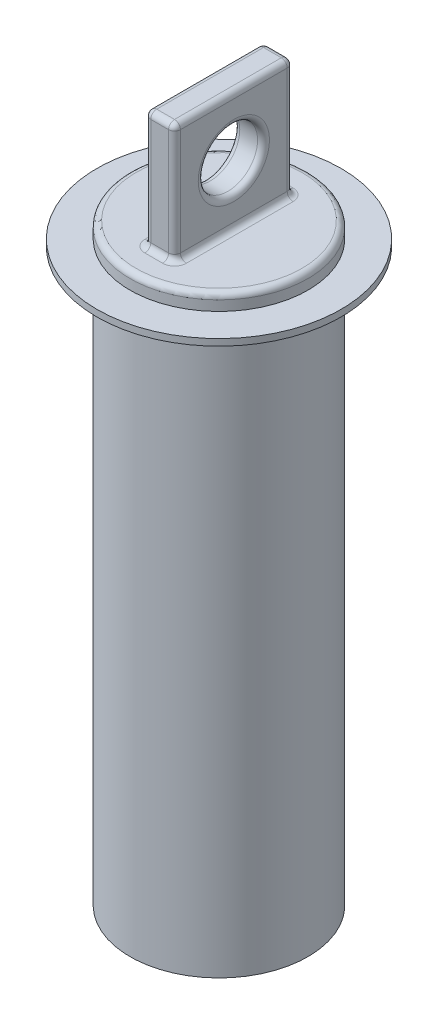
from build123d import *

# Parameters (mm, degrees)
SKETCH2_W               = 5
SKETCH2_H               = 20
BOSS_EXTRUDE1_DEPTH     = 20
CUT_EXTRUDE1_DEPTH      = 65.274800661
CUT_EXTRUDE1_DEPTH_BACK = 65.274800661
SKETCH3_R               = 5
FILLET2_R               = 1
SKETCH4_W               = 5.586282465
SKETCH4_H               = 1.117897551


with BuildPart() as part:
    # Sketch1 → Revolve1 (revolve)
    with BuildSketch(Plane(origin=(0, 0, 0), x_dir=(0, 0, -1), z_dir=(1, 0, 0)), mode=Mode.PRIVATE) as revolve1_sk:
        Polygon((-15, 40), (-15, -60), (-13, -60), (-13, 38), (0, 38), (0, 40), align=None)
    revolve(revolve1_sk.sketch.rotate(Axis((0, 0, 0), (0, 1, 0)), 180), axis=Axis((0, 0, 0), (0, 1, 0)))

    # Sketch2 → Boss-Extrude1 (add)
    with BuildSketch(Plane(origin=(0, 40, 0), x_dir=(1, 0, 0), z_dir=(0, 1, 0))):
        Rectangle(SKETCH2_W, SKETCH2_H)
    extrude(amount=BOSS_EXTRUDE1_DEPTH)

    # Sketch3 → Cut-Extrude1 (cut, two sides: drawn at the far end of the back side and taken through both)
    with BuildSketch(Plane(origin=(2.5, 0, 0), x_dir=(0, 0, -1), z_dir=(1, 0, 0)).offset(-CUT_EXTRUDE1_DEPTH_BACK)):
        with Locations((0, 50)):
            Circle(SKETCH3_R)
    extrude(amount=CUT_EXTRUDE1_DEPTH + CUT_EXTRUDE1_DEPTH_BACK, mode=Mode.SUBTRACT)

    # Fillet2
    fillet2_edges = [part.edges().sort_by_distance(p)[0] for p in [
        (-2.5, 40, 0),
        (-2.5, 50, -10),
        (0, 40, 10),
        (-2.5, 50, 10),
        (2.5, 40, 0),
        (2.5, 50, 10),
        (0, 40, -10),
        (2.5, 50, -10),
        (-2.5, 60, 0),
        (0, 60, 10),
        (2.5, 60, 0),
        (0, 60, -10),
        (2.5, 50, 5),
        (-2.5, 50, 5),
        (0, 38, 13),
        (0, 40, 15),
    ]]
    fillet(fillet2_edges, radius=FILLET2_R)

    # Sketch4 → Revolve2 (revolve)
    with BuildSketch(Plane.XY, mode=Mode.PRIVATE) as revolve2_sk:
        with Locations((17.793141233, 36.750165078)):
            Rectangle(SKETCH4_W, SKETCH4_H)
    revolve(revolve2_sk.sketch.rotate(Axis((0, 0, 0), (0, 1, 0)), 90), axis=Axis((0, 0, 0), (0, 1, 0)))


solid = part.part
